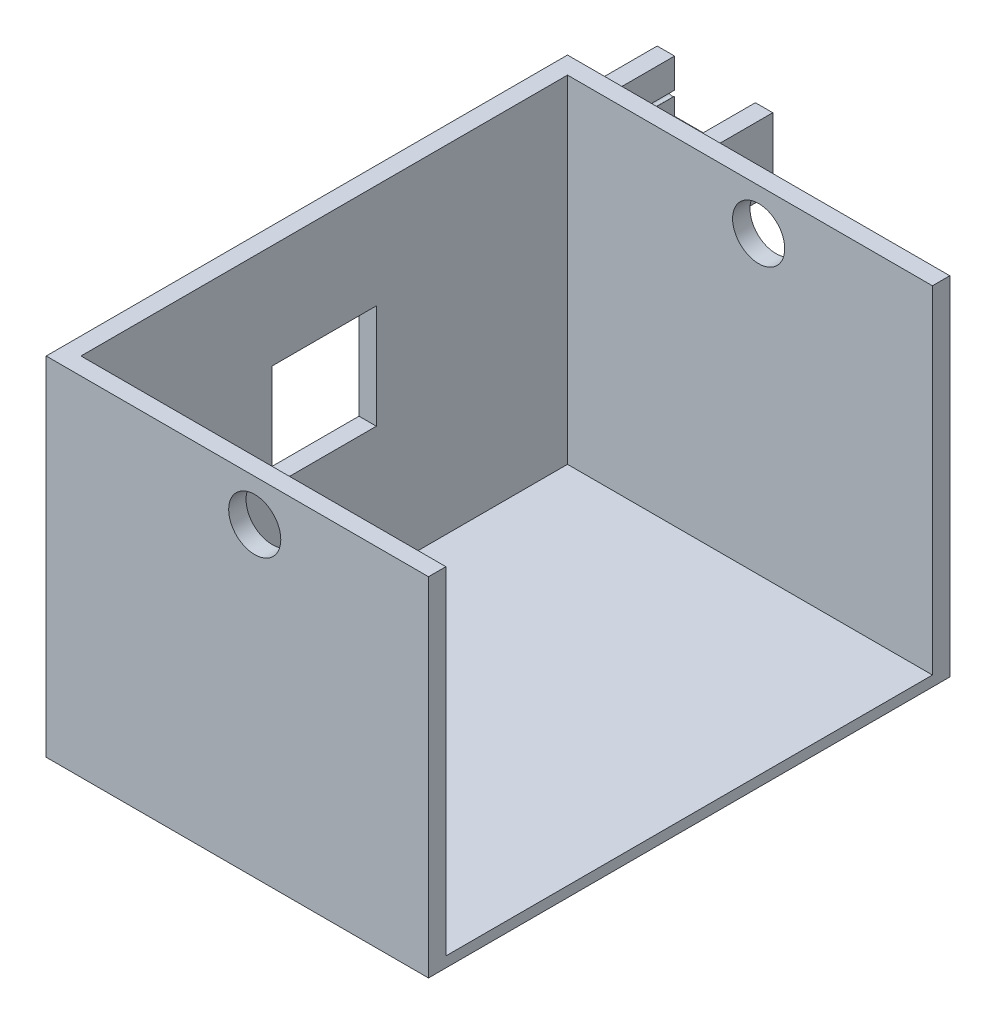
from build123d import *

# Parameters (mm, degrees)
COLLECTORSIZE_W         = 110
COLLECTORSIZE_H         = 150
BOSS_EXTRUDE1_DEPTH     = 200
COLLECTORSHAPE_W        = 110
COLLECTORSHAPE_H        = 100
CUT_EXTRUDE1_DEPTH      = 289.064276605
COLLECTORWALLS_W        = 129.645083566
COLLECTORWALLS_H        = 140
CUT_EXTRUDE2_DEPTH      = 97
CUT_EXTRUDE5_DEPTH      = 231.176079244
CUT_EXTRUDE5_DEPTH_BACK = 231.176079244
SKETCH1_R               = 7.5
BOSS_EXTRUDE3_DEPTH     = 18.25
SKETCH4_R               = 1.083059031
SKETCH4_R_2             = 1
CUT_EXTRUDE6_DEPTH      = 18.25
SKETCH2_2_W             = 30
SKETCH2_2_H             = 30
CUT_EXTRUDE7_DEPTH      = 10


with BuildPart() as part:
    # CollectorSize → Boss-Extrude1 (new body)
    with BuildSketch(Plane(origin=(0, 0, 0), x_dir=(1, 0, 0), z_dir=(0, 1, 0))):
        with Locations((88.111940299, -4.391791045)):
            Rectangle(COLLECTORSIZE_W, COLLECTORSIZE_H)
    extrude(amount=BOSS_EXTRUDE1_DEPTH)

    # CollectorShape → Cut-Extrude1 (cut, through all)
    with BuildSketch(Plane.XY.offset(79.391791045)):
        with Locations((88.111940299, 150)):
            Rectangle(COLLECTORSHAPE_W, COLLECTORSHAPE_H)
    extrude(amount=-CUT_EXTRUDE1_DEPTH, mode=Mode.SUBTRACT)

    # CollectorWalls → Cut-Extrude2 (cut)
    with BuildSketch(Plane(origin=(0, 100, 0), x_dir=(1, 0, 0), z_dir=(0, 1, 0))):
        with Locations((102.934482082, -4.391791045)):
            Rectangle(COLLECTORWALLS_W, COLLECTORWALLS_H)
    extrude(amount=-CUT_EXTRUDE2_DEPTH, mode=Mode.SUBTRACT)

    # Sketch1 → Cut-Extrude5 (cut, two sides: drawn at the far end of the back side and taken through both)
    with BuildSketch(Plane.XY.offset(79.391791045).offset(-CUT_EXTRUDE5_DEPTH_BACK)):
        with Locations((93.111940299, 88)):
            Circle(SKETCH1_R)
    extrude(amount=CUT_EXTRUDE5_DEPTH + CUT_EXTRUDE5_DEPTH_BACK, mode=Mode.SUBTRACT)

    # Sketch3 → Boss-Extrude3 (add)
    with BuildSketch(Plane(origin=(0, 0, -70.608208955), x_dir=(-1, 0, 0), z_dir=(0, 0, -1))):
        Polygon((-45.669947857, 81.9), (-68.919947857, 81.9), (-68.919947857, 96.9), (-73.919947857, 96.9), (-73.919947857, 76.9), (-40.669947857, 76.9), (-40.669947857, 96.9), (-45.669947857, 96.9), align=None)
    extrude(amount=BOSS_EXTRUDE3_DEPTH)

    # Sketch4 → Cut-Extrude6 (cut)
    with BuildSketch(Plane(origin=(0, 0, -88.858208955), x_dir=(-1, 0, 0), z_dir=(0, 0, -1))):
        with Locations((-44.876021334, 87.650563986)):
            Circle(SKETCH4_R)
        with Locations((-70.994947857, 88)):
            Circle(SKETCH4_R_2)
    extrude(amount=-CUT_EXTRUDE6_DEPTH, mode=Mode.SUBTRACT)

    # Sketch2<2> → Cut-Extrude7 (cut)
    with BuildSketch(Plane.ZY.offset(-33.111940299)):
        with Locations((4.391791045, 55)):
            Rectangle(SKETCH2_2_W, SKETCH2_2_H)
    extrude(amount=-CUT_EXTRUDE7_DEPTH, mode=Mode.SUBTRACT)


solid = part.part
